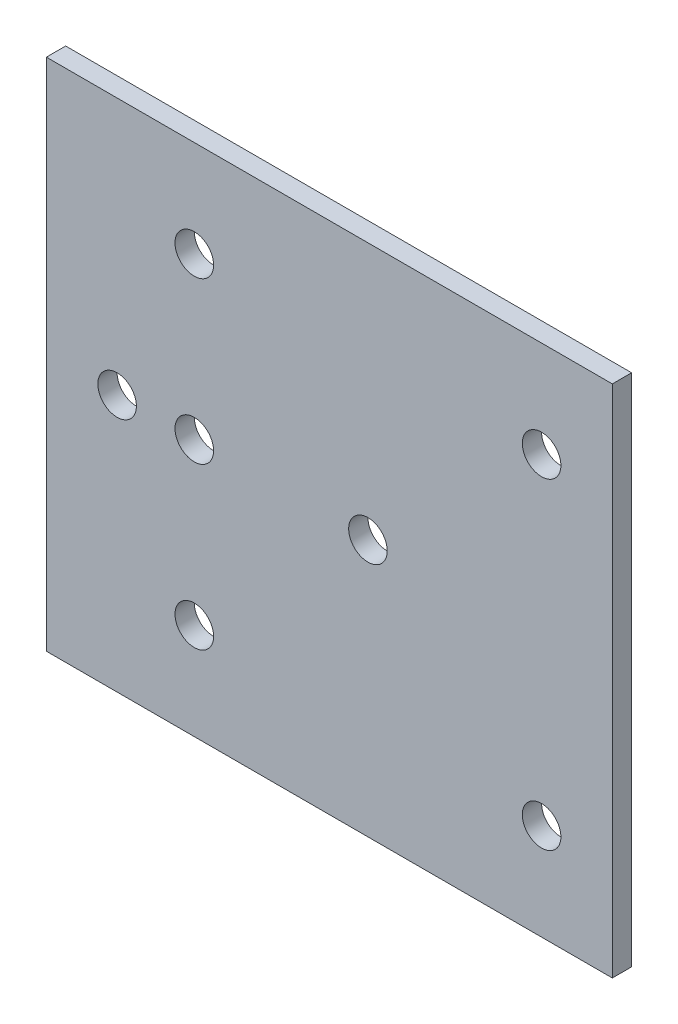
from build123d import *

# Parameters (mm, degrees)
SKETCH_1_W      = 88
SKETCH_1_H      = 80
SKETCH_1_R      = 3
EXTRUDE_1_DEPTH = 3


with BuildPart() as part:
    # 草图1 → 凸台-拉伸1 (new body)
    with BuildSketch(Plane.XY):
        with Locations((-6, 0)):
            Rectangle(SKETCH_1_W, SKETCH_1_H)
        with Locations((-27, 25)):
            Circle(SKETCH_1_R, mode=Mode.SUBTRACT)
        with Locations(Location((27, 25, 0), (0, 0, 180))):
            Circle(SKETCH_1_R, mode=Mode.SUBTRACT)
        with Locations((27, -25)):
            Circle(SKETCH_1_R, mode=Mode.SUBTRACT)
        with Locations(Location((-27, -25, 0), (0, 0, 180))):
            Circle(SKETCH_1_R, mode=Mode.SUBTRACT)
        with Locations(Location((0, 0, 0), (0, 0, 180))):
            Circle(SKETCH_1_R, mode=Mode.SUBTRACT)
        with Locations(Location((-39, 0, 0), (0, 0, 180))):
            Circle(SKETCH_1_R, mode=Mode.SUBTRACT)
        with Locations(Location((-27, 0, 0), (0, 0, 180))):
            Circle(SKETCH_1_R, mode=Mode.SUBTRACT)
    extrude(amount=EXTRUDE_1_DEPTH)


solid = part.part
